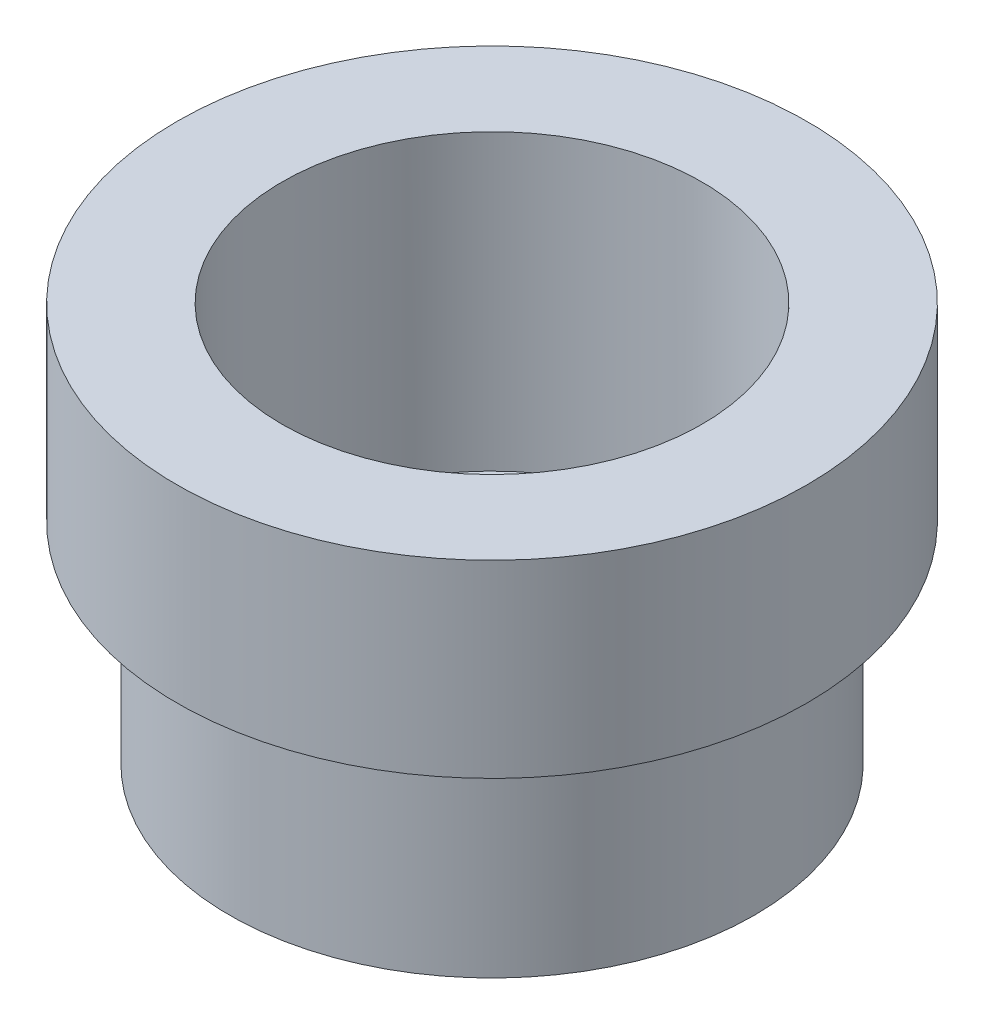
from build123d import *

# Parameters (mm, degrees)
SKETCH3_R              = 10
BORE_THROUGH_DEPTH     = 57.956123464
SKETCH5_R              = 20
CENTER_CAVITY_DEPTH    = 28
M4_PATTERN_ALIGNMENT_R = 2.15
CUT_EXTRUDE1_DEPTH     = 51.833060109
CIRPATTERN1_COUNT      = 6
SKETCH7_R              = 4
CUT_EXTRUDE2_DEPTH     = 4
CIRPATTERN2_COUNT      = 6


with BuildPart() as part:
    # Sketch1 → Revolve1 (revolve)
    with BuildSketch(Plane.XY, mode=Mode.PRIVATE) as revolve1_sk:
        Polygon((0, 0), (25, 0), (25, 20), (30, 20), (30, 38), (0, 38), align=None)
    revolve(revolve1_sk.sketch.rotate(Axis((0, 38, 0), (0, -1, 0)), 180), axis=Axis((0, 38, 0), (0, -1, 0)))

    # Sketch3 → bore through (cut, through all)
    with BuildSketch(Plane(origin=(0, 38, 0), x_dir=(1, 0, 0), z_dir=(0, 1, 0))):
        with Locations(Location((0, 0, 0), (0, 0, 270))):
            Circle(SKETCH3_R)
    extrude(amount=-BORE_THROUGH_DEPTH, mode=Mode.SUBTRACT)

    # Sketch5 → center cavity (cut)
    with BuildSketch(Plane(origin=(0, 38, 0), x_dir=(1, 0, 0), z_dir=(0, 1, 0))):
        with Locations(Location((0, 0, 0), (0, 0, 270))):
            Circle(SKETCH5_R)
    extrude(amount=-CENTER_CAVITY_DEPTH, mode=Mode.SUBTRACT)

    # m4 pattern alignment → Cut-Extrude1 (cut, through all)
    with BuildSketch(Plane(origin=(0, 10, 0), x_dir=(1, 0, 0), z_dir=(0, 1, 0))):
        with Locations(Location((0, 15, 0), (0, 0, 180))):
            Circle(M4_PATTERN_ALIGNMENT_R)
    cut_extrude1 = extrude(amount=-CUT_EXTRUDE1_DEPTH, mode=Mode.SUBTRACT)

    # CirPattern1: Cut-Extrude1 ×6 about axis
    cirpattern1_axis = Axis((0, 0, 0), (0, 1, 0))
    for i in range(1, CIRPATTERN1_COUNT):
        add(cut_extrude1.rotate(cirpattern1_axis, i * 360 / CIRPATTERN1_COUNT), mode=Mode.SUBTRACT)

    # Sketch7 → Cut-Extrude2 (cut)
    with BuildSketch(Plane(origin=(0, 10, 0), x_dir=(1, 0, 0), z_dir=(0, 1, 0))):
        with Locations(Location((0, 15, 0), (0, 0, 180))):
            Circle(SKETCH7_R)
    cut_extrude2 = extrude(amount=-CUT_EXTRUDE2_DEPTH, mode=Mode.SUBTRACT)

    # CirPattern2: Cut-Extrude2 ×6 about axis
    cirpattern2_axis = Axis((0, 0, 0), (0, 1, 0))
    for i in range(1, CIRPATTERN2_COUNT):
        add(cut_extrude2.rotate(cirpattern2_axis, i * 360 / CIRPATTERN2_COUNT), mode=Mode.SUBTRACT)


solid = part.part
